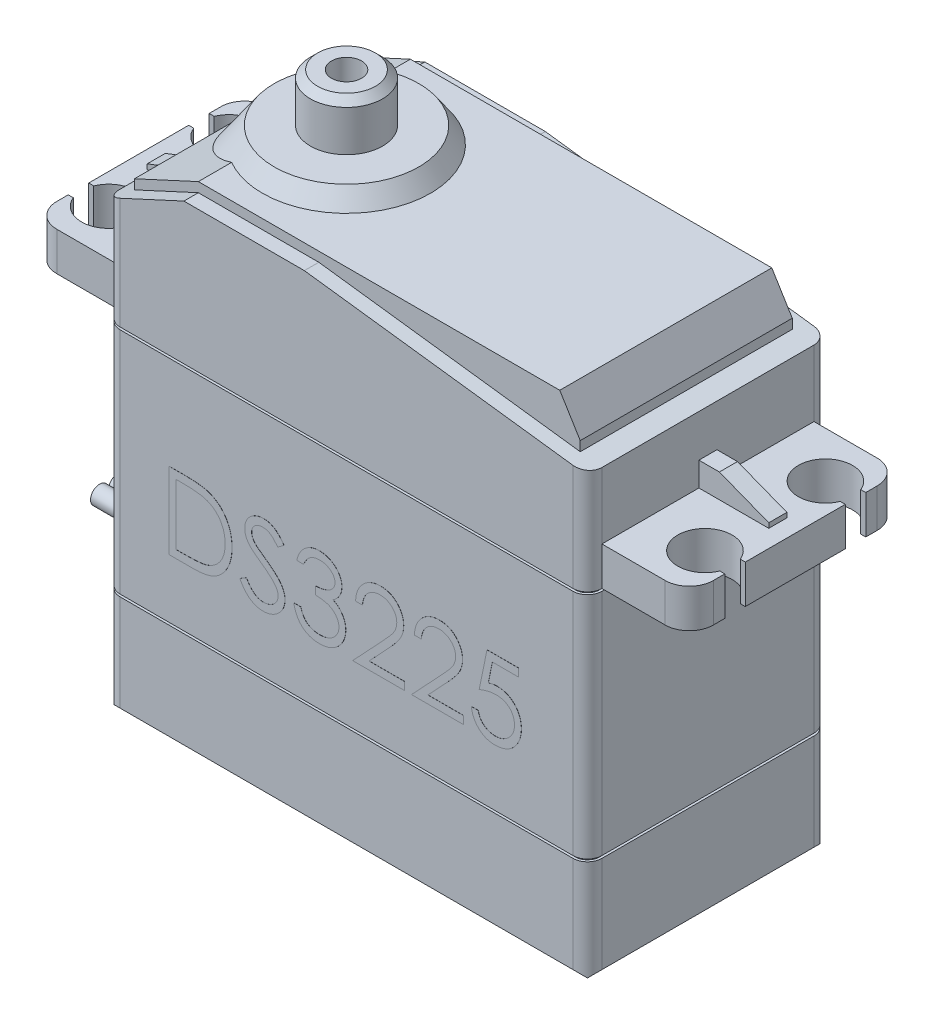
from build123d import *

# Parameters (mm, degrees)
SKETCH1_W              = 40
SKETCH1_H              = 20
BOSS_EXTRUDE1_DEPTH    = 41.5
CHAMFER1_SIZE          = 1.6
FILLET2_R              = 1.2
BOSS_EXTRUDE3_DEPTH    = 3.2
CUT_EXTRUDE1_REACH     = 55.524
BOSS_EXTRUDE4_DEPTH    = 8.8
BOSS_EXTRUDE5_REACH    = 53.797
SKETCH6_R              = 6
BOSS_EXTRUDE5_DRAFT    = 35
SKETCH7_R              = 3
SKETCH7_R_2            = 1.25
BOSS_EXTRUDE6_DEPTH    = 4
CHAMFER2_SIZE          = 0.6
BOSS_EXTRUDE7_DEPTH    = 0.75
CUT_EXTRUDE2_START     = -0.2
CUT_EXTRUDE2_DEPTH     = 0.2
LPATTERN1_COUNT        = 2
LPATTERN1_PITCH        = 19.2
BOSS_EXTRUDE8_DEPTH    = 0.6
SKETCH11_W             = 6.4
SKETCH11_H             = 3.4
BOSS_EXTRUDE9_DEPTH    = 4.2
BOSS_EXTRUDE9_TAPER    = 5
FILLET3_R              = 0.5
SKETCH12_R             = 0.75
BOSS_EXTRUDE11_DEPTH   = 4.2
BOSS_EXTRUDE11_2_DEPTH = 4.2
BOSS_EXTRUDE11_3_DEPTH = 4.2
BOSS_EXTRUDE12_DEPTH   = 0.01


with BuildPart() as part:
    # Sketch1 → Boss-Extrude1 (new body)
    with BuildSketch(Plane(origin=(0, 0, 0), x_dir=(1, 0, 0), z_dir=(0, 1, 0))):
        Rectangle(SKETCH1_W, SKETCH1_H)
    extrude(amount=BOSS_EXTRUDE1_DEPTH)

    # Chamfer1
    chamfer1_edges = [part.edges().sort_by_distance(p)[0] for p in [
        (0, 0, 10),
        (-20, 0, 0),
        (0, 0, -10),
        (20, 0, 0),
    ]]
    chamfer(chamfer1_edges, length=CHAMFER1_SIZE)

    # Fillet2
    fillet2_edges = [part.edges().sort_by_distance(p)[0] for p in [
        (20, 21.55, 10),
        (-20, 21.55, 10),
        (-20, 21.55, -10),
        (20, 21.55, -10),
    ]]
    fillet(fillet2_edges, radius=FILLET2_R)

    # Sketch3 → Boss-Extrude3 (add)
    with BuildSketch(Plane(origin=(0, 29, 0), x_dir=(-1, 0, 0), z_dir=(0, -1, 0))):
        with BuildLine():
            Line((25.25, 8.8), (20, 8.8))
            Line((20, 8.8), (20, 5.85))
            Line((20, 5.85), (22.666733334, 5.85))
            ThreePointArc((22.666733334, 5.85), (24.75, 7.25), (26.833266666, 5.85))
            Line((26.833266666, 5.85), (27.25, 5.85))
            Line((27.25, 5.85), (27.25, 6.8))
            ThreePointArc((27.25, 6.8), (26.664213562, 8.214213562), (25.25, 8.8))
        make_face()
        with BuildLine():
            Line((22.666733334, 4.15), (20, 4.15))
            Line((20, 4.15), (20, -4.15))
            Line((20, -4.15), (22.666733334, -4.15))
            ThreePointArc((22.666733334, -4.15), (24.75, -2.75), (26.833266666, -4.15))
            Line((26.833266666, -4.15), (27.25, -4.15))
            Line((27.25, -4.15), (27.25, 4.15))
            Line((27.25, 4.15), (26.833266666, 4.15))
            ThreePointArc((26.833266666, 4.15), (24.75, 2.75), (22.666733334, 4.15))
        make_face()
        with BuildLine():
            Line((22.666733334, -5.85), (20, -5.85))
            Line((20, -5.85), (20, -8.8))
            Line((20, -8.8), (25.25, -8.8))
            ThreePointArc((25.25, -8.8), (26.664213562, -8.214213562), (27.25, -6.8))
            Line((27.25, -6.8), (27.25, -5.85))
            Line((27.25, -5.85), (26.833266666, -5.85))
            ThreePointArc((26.833266666, -5.85), (24.75, -7.25), (22.666733334, -5.85))
        make_face()
        with BuildLine():
            Line((22.666733334, -4.15), (20, -4.15))
            Line((20, -4.15), (20, -5.85))
            Line((20, -5.85), (22.666733334, -5.85))
            ThreePointArc((22.666733334, -5.85), (22.5, -5), (22.666733334, -4.15))
        make_face()
        with BuildLine():
            Line((22.666733334, 5.85), (20, 5.85))
            Line((20, 5.85), (20, 4.15))
            Line((20, 4.15), (22.666733334, 4.15))
            ThreePointArc((22.666733334, 4.15), (22.5, 5), (22.666733334, 5.85))
        make_face()
        with BuildLine():
            Line((-20, 5.85), (-20, 8.8))
            Line((-20, 8.8), (-25.25, 8.8))
            ThreePointArc((-25.25, 8.8), (-26.664213562, 8.214213562), (-27.25, 6.8))
            Line((-27.25, 6.8), (-27.25, 5.85))
            Line((-27.25, 5.85), (-26.833266666, 5.85))
            ThreePointArc((-26.833266666, 5.85), (-24.75, 7.25), (-22.666733334, 5.85))
            Line((-22.666733334, 5.85), (-20, 5.85))
        make_face()
        with BuildLine():
            Line((-20, 4.15), (-20, 5.85))
            Line((-20, 5.85), (-22.666733334, 5.85))
            ThreePointArc((-22.666733334, 5.85), (-22.542076768, 5.433099297), (-22.5, 5))
            ThreePointArc((-22.5, 5), (-22.542076768, 4.566900703), (-22.666733334, 4.15))
            Line((-22.666733334, 4.15), (-20, 4.15))
        make_face()
        with BuildLine():
            Line((-20, -4.15), (-20, 4.15))
            Line((-20, 4.15), (-22.666733334, 4.15))
            ThreePointArc((-22.666733334, 4.15), (-24.75, 2.75), (-26.833266666, 4.15))
            Line((-26.833266666, 4.15), (-27.25, 4.15))
            Line((-27.25, 4.15), (-27.25, -4.15))
            Line((-27.25, -4.15), (-26.833266666, -4.15))
            ThreePointArc((-26.833266666, -4.15), (-24.75, -2.75), (-22.666733334, -4.15))
            Line((-22.666733334, -4.15), (-20, -4.15))
        make_face()
        with BuildLine():
            Line((-20, -5.85), (-20, -4.15))
            Line((-20, -4.15), (-22.666733334, -4.15))
            ThreePointArc((-22.666733334, -4.15), (-22.542076768, -4.566900703), (-22.5, -5))
            ThreePointArc((-22.5, -5), (-22.542076768, -5.433099297), (-22.666733334, -5.85))
            Line((-22.666733334, -5.85), (-20, -5.85))
        make_face()
        with BuildLine():
            Line((-20, -8.8), (-20, -5.85))
            Line((-20, -5.85), (-22.666733334, -5.85))
            ThreePointArc((-22.666733334, -5.85), (-24.75, -7.25), (-26.833266666, -5.85))
            Line((-26.833266666, -5.85), (-27.25, -5.85))
            Line((-27.25, -5.85), (-27.25, -6.8))
            ThreePointArc((-27.25, -6.8), (-26.664213562, -8.214213562), (-25.25, -8.8))
            Line((-25.25, -8.8), (-20, -8.8))
        make_face()
    extrude(amount=-BOSS_EXTRUDE3_DEPTH)

    # Sketch4 → Cut-Extrude1 (cut, up to next)
    with BuildSketch(Plane.XY.offset(10), mode=Mode.PRIVATE) as cut_extrude1_sk1:
        Polygon((-20, 37.7), (-13.5, 40.7), (-3.5, 40.7), (20, 37.7), (20, 41.5), (-20, 41.5), align=None)
    cut_extrude1_tool1 = extrude(cut_extrude1_sk1.sketch, amount=-CUT_EXTRUDE1_REACH, mode=Mode.PRIVATE) & part.part
    add(cut_extrude1_tool1.solids().sort_by_distance((3.311688, 40.281818, 10))[0], mode=Mode.SUBTRACT)

    # Sketch5 → Boss-Extrude4 (add, symmetric)
    with BuildSketch(Plane.XY):
        Polygon((-13.5, 41.5), (16.5, 41.5), (18.2, 38.729787234), (18.2, 37.929787234), (-3.5, 40.7), (-13.5, 40.7), (-18.8, 38.253846154), (-18.8, 39.053846154), align=None)
    extrude(amount=BOSS_EXTRUDE4_DEPTH, both=True)




with BuildPart() as boss_extrude5_long_prism_1:
    # Sketch6 → Boss-Extrude5 (the long prism of profile 1, to be tilted and cut off)
    with BuildSketch(Plane(origin=(0, 42.9, 0), x_dir=(1, 0, 0), z_dir=(0, 1, 0))):
        with Locations((-10, 0)):
            Circle(SKETCH6_R)
    extrude(amount=-BOSS_EXTRUDE5_REACH)
    boss_extrude5_tool1_sides = [boss_extrude5_long_prism_1.faces().sort_by_distance(p)[0] for p in [
        (-16, 16.0015, 0),
    ]]
    draft(boss_extrude5_tool1_sides, Plane(origin=(0, 42.9, 0), x_dir=(1, 0, 0), z_dir=(0, 1, 0)), BOSS_EXTRUDE5_DRAFT)  # the draft: side faces tilted about the start plane


with BuildPart() as part_1:
    add(part.part)
    boss_extrude5_tool1 = boss_extrude5_long_prism_1.part - part.part
    add(boss_extrude5_tool1.solids().sort_by_distance((-10, 42.9, 0))[0])

    # Sketch7 → Boss-Extrude6 (add)
    with BuildSketch(Plane(origin=(0, 42.9, 0), x_dir=(1, 0, 0), z_dir=(0, 1, 0))):
        with Locations(Location((-10, 0, 0), (0, 0, 270))):
            Circle(SKETCH7_R)
        with Locations(Location((-10, 0, 0), (0, 0, 270))):
            Circle(SKETCH7_R_2, mode=Mode.SUBTRACT)
    extrude(amount=BOSS_EXTRUDE6_DEPTH)

    # Chamfer2
    chamfer2_edges = [part_1.edges().sort_by_distance(p)[0] for p in [
        (-10, 46.9, -3),
    ]]
    chamfer(chamfer2_edges, length=CHAMFER2_SIZE)

    # Sketch8 → Boss-Extrude7 (add, symmetric)
    with BuildSketch(Plane.XY):
        Polygon((-20, 34.2), (-21.7, 34.2), (-25.8, 32.6), (-25.8, 32.2), (-20, 32.2), align=None)
        Polygon((20, 32.2), (20, 34.2), (21.7, 34.2), (25.8, 32.6), (25.8, 32.2), align=None)
    extrude(amount=BOSS_EXTRUDE7_DEPTH, both=True)

    # Sketch9 → Cut-Extrude2 (cut)
    with BuildSketch(Plane(origin=(0, 9.6, 0), x_dir=(-1, 0, 0), z_dir=(0, -1, 0)).offset(CUT_EXTRUDE2_START)):
        with BuildLine():
            Line((20, 8.8), (20, -8.8))
            ThreePointArc((20, -8.8), (19.908655439, -9.259220119), (19.648528137, -9.648528137))
            ThreePointArc((19.648528137, -9.648528137), (19.259220119, -9.908655439), (18.8, -10))
            Line((18.8, -10), (-18.8, -10))
            ThreePointArc((-18.8, -10), (-19.259220119, -9.908655439), (-19.648528137, -9.648528137))
            ThreePointArc((-19.648528137, -9.648528137), (-19.908655439, -9.259220119), (-20, -8.8))
            Line((-20, -8.8), (-20, 8.8))
            ThreePointArc((-20, 8.8), (-19.908655439, 9.259220119), (-19.648528137, 9.648528137))
            ThreePointArc((-19.648528137, 9.648528137), (-19.259220119, 9.908655439), (-18.8, 10))
            Line((-18.8, 10), (18.8, 10))
            ThreePointArc((18.8, 10), (19.259220119, 9.908655439), (19.648528137, 9.648528137))
            ThreePointArc((19.648528137, 9.648528137), (19.908655439, 9.259220119), (20, 8.8))
        make_face()
        with BuildLine():
            Line((-18.8, 9.8), (18.8, 9.8))
            ThreePointArc((18.8, 9.8), (19.182683432, 9.723879533), (19.507106781, 9.507106781))
            ThreePointArc((19.507106781, 9.507106781), (19.723879533, 9.182683432), (19.8, 8.8))
            Line((19.8, 8.8), (19.8, -8.8))
            ThreePointArc((19.8, -8.8), (19.723879533, -9.182683432), (19.507106781, -9.507106781))
            ThreePointArc((19.507106781, -9.507106781), (19.182683432, -9.723879533), (18.8, -9.8))
            Line((18.8, -9.8), (-18.8, -9.8))
            ThreePointArc((-18.8, -9.8), (-19.182683432, -9.723879533), (-19.507106781, -9.507106781))
            ThreePointArc((-19.507106781, -9.507106781), (-19.723879533, -9.182683432), (-19.8, -8.8))
            Line((-19.8, -8.8), (-19.8, 8.8))
            ThreePointArc((-19.8, 8.8), (-19.723879533, 9.182683432), (-19.507106781, 9.507106781))
            ThreePointArc((-19.507106781, 9.507106781), (-19.182683432, 9.723879533), (-18.8, 9.8))
        make_face(mode=Mode.SUBTRACT)
    cut_extrude2 = extrude(amount=CUT_EXTRUDE2_DEPTH, mode=Mode.SUBTRACT)

    # LPattern1: Cut-Extrude2 ×2
    with Locations(*[(0, i * LPATTERN1_PITCH, 0) for i in range(1, LPATTERN1_COUNT)]):
        add(cut_extrude2, mode=Mode.SUBTRACT)

    # Sketch10 → Boss-Extrude8 (add)
    with BuildSketch(Plane.ZY.offset(20)):
        with BuildLine():
            Line((-3, 9.6), (3, 9.6))
            ThreePointArc((3, 9.6), (3.353553391, 9.453553391), (3.5, 9.1))
            Line((3.5, 9.1), (3.5, 6.1))
            ThreePointArc((3.5, 6.1), (3.353553391, 5.746446609), (3, 5.6))
            Line((3, 5.6), (-3, 5.6))
            ThreePointArc((-3, 5.6), (-3.353553391, 5.746446609), (-3.5, 6.1))
            Line((-3.5, 6.1), (-3.5, 9.1))
            ThreePointArc((-3.5, 9.1), (-3.353553391, 9.453553391), (-3, 9.6))
        make_face()
    extrude(amount=BOSS_EXTRUDE8_DEPTH)

    # Sketch11 → Boss-Extrude9 (add)
    with BuildSketch(Plane.ZY.offset(20.6)):
        with Locations((0, 7.6)):
            Rectangle(SKETCH11_W, SKETCH11_H)
    extrude(amount=BOSS_EXTRUDE9_DEPTH, taper=BOSS_EXTRUDE9_TAPER)

    # Fillet3
    fillet3_edges = [part_1.edges().sort_by_distance(p)[0] for p in [
        (-22.7, 6.083726193, 3.016273807),
        (-22.7, 9.116273807, 3.016273807),
        (-22.7, 9.116273807, -3.016273807),
        (-22.7, 6.083726193, -3.016273807),
        (-24.8, 7.6, 2.832547613),
        (-24.8, 8.932547613, 0),
        (-24.8, 7.6, -2.832547613),
        (-24.8, 6.267452387, 0),
    ]]
    fillet(fillet3_edges, radius=FILLET3_R)

    # Sketch13 → Boss-Extrude12 (add)
    # profile 1 of 6: a face of its own
    with BuildSketch(Plane.XY.offset(10)):
        with BuildLine():
            Line((-14.705907337, 14.680709797), (-14.705907337, 21.030709797))
            Line((-14.705907337, 21.030709797), (-13.423695799, 21.030709797))
            add(Edge.make_bspline(
                [(-13.423695799, 21.030709797), (-13.312173491, 21.029906849), (-13.096712974, 21.028355556), (-12.785358963, 21.018519604), (-12.497279851, 21.001119759), (-12.233423092, 20.975775047), (-11.993064322, 20.944654543), (-11.776876561, 20.905646667), (-11.583741959, 20.859585272), (-11.464961688, 20.820314241), (-11.408791952, 20.801743451)],
                knots=[0, 0, 0, 0, 1.314313732, 2.53924729, 3.670748893, 4.714932338, 5.66265055, 6.526160246, 7.303039223, 8, 8, 8, 8], degree=3))
            add(Edge.make_bspline(
                [(-11.408791952, 20.801743451), (-11.335322925, 20.773747742), (-11.190050905, 20.718391174), (-10.983209411, 20.613967599), (-10.788490539, 20.4956524), (-10.60485009, 20.363289621), (-10.436482876, 20.213131446), (-10.276811407, 20.051556447), (-10.132367551, 19.87268903), (-10.000091071, 19.680238695), (-9.880827803, 19.476472543), (-9.777161045, 19.261778846), (-9.691065943, 19.037247911), (-9.619595374, 18.803504143), (-9.56326823, 18.560033571), (-9.524838154, 18.3065527), (-9.499490787, 18.044063314), (-9.496943436, 17.865946787), (-9.495650927, 17.775571576)],
                knots=[0, 0, 0, 0, 0.984719456, 1.947108742, 2.898477687, 3.838006223, 4.779231079, 5.722358779, 6.681677486, 7.655904652, 8.64651281, 9.637519902, 10.640069247, 11.656948941, 12.698408672, 13.768548281, 14.867775369, 16, 16, 16, 16], degree=3))
            add(Edge.make_bspline(
                [(-9.495650927, 17.775571576), (-9.496792054, 17.697083329), (-9.499040763, 17.54241404), (-9.519232522, 17.314465558), (-9.548580988, 17.093279508), (-9.594018318, 16.879909166), (-9.649177164, 16.672485114), (-9.719869267, 16.473218042), (-9.80085081, 16.280279988), (-9.895284161, 16.09627971), (-9.99895496, 15.92195702), (-10.110210123, 15.757627133), (-10.228930984, 15.605634945), (-10.356249633, 15.465520178), (-10.490520775, 15.337494057), (-10.632623489, 15.220487115), (-10.782924453, 15.116788794), (-10.940750478, 15.022324183), (-11.110705741, 14.939918681), (-11.296009384, 14.870195663), (-11.497451664, 14.812416804), (-11.714538129, 14.764209607), (-11.947643867, 14.725969358), (-12.19699742, 14.700340046), (-12.462215674, 14.683008297), (-12.644332341, 14.68149084), (-12.738068795, 14.680709797)],
                knots=[0, 0, 0, 0, 1.105936401, 2.179363191, 3.223086493, 4.248585256, 5.251745608, 6.245858792, 7.225916811, 8.198733463, 9.158002045, 10.082870192, 10.993790845, 11.873723703, 12.748670949, 13.606408763, 14.465103618, 15.319838547, 16.196477973, 17.123216899, 18.106603292, 19.147568657, 20.255746949, 21.433717677, 22.679120308, 24, 24, 24, 24], degree=3))
            Line((-12.738068795, 14.680709797), (-14.705907337, 14.680709797))
        make_face()
        with BuildLine():
            Line((-14.136035542, 15.331991848), (-13.40715934, 15.331991848))
            add(Edge.make_bspline(
                [(-13.40715934, 15.331991848), (-13.302423582, 15.332441966), (-13.100978362, 15.333307707), (-12.811313138, 15.34090449), (-12.546646233, 15.35331772), (-12.306940066, 15.370689646), (-12.092329979, 15.393674134), (-11.902367462, 15.419300743), (-11.737675207, 15.451227547), (-11.638017515, 15.480167145), (-11.591965029, 15.493540326)],
                knots=[0, 0, 0, 0, 1.375205317, 2.645023457, 3.804390687, 4.853969522, 5.800190428, 6.637939096, 7.370582563, 8, 8, 8, 8], degree=3))
            add(Edge.make_bspline(
                [(-11.591965029, 15.493540326), (-11.534001573, 15.513953867), (-11.419459115, 15.554293373), (-11.25457486, 15.627876558), (-11.100801437, 15.715038599), (-10.955458963, 15.811925582), (-10.820609174, 15.921954757), (-10.694653991, 16.042733551), (-10.577847009, 16.174876643), (-10.47139505, 16.318220022), (-10.376129984, 16.471871508), (-10.293632182, 16.634320535), (-10.221330118, 16.803787176), (-10.164581814, 16.982873793), (-10.12010354, 17.16997937), (-10.088599035, 17.365117071), (-10.068978035, 17.568250454), (-10.066689408, 17.706412165), (-10.065522722, 17.776843611)],
                knots=[0, 0, 0, 0, 0.998632004, 1.973411704, 2.929992603, 3.868527914, 4.809262121, 5.754881198, 6.702106254, 7.672490631, 8.653608572, 9.636854334, 10.631411391, 11.644891563, 12.686317036, 13.754757253, 14.855430412, 16, 16, 16, 16], degree=3))
            add(Edge.make_bspline(
                [(-10.065522722, 17.776843611), (-10.066453972, 17.85110864), (-10.06828342, 17.997002946), (-10.091278241, 18.211071778), (-10.124881634, 18.416958102), (-10.173474893, 18.614675685), (-10.235398059, 18.804610266), (-10.312676909, 18.985711378), (-10.400972061, 19.15989164), (-10.506025258, 19.323130846), (-10.621079263, 19.477514059), (-10.748764844, 19.618946548), (-10.8870534, 19.747750493), (-11.034436627, 19.865931817), (-11.195068221, 19.968735915), (-11.365164203, 20.060696037), (-11.547219921, 20.138739154), (-11.673880097, 20.180247948), (-11.738249084, 20.20134281)],
                knots=[0, 0, 0, 0, 1.122418816, 2.205001699, 3.251619955, 4.274784885, 5.280384055, 6.268708349, 7.249350384, 8.229342522, 9.199999885, 10.157847722, 11.105861043, 12.055065948, 13.010012805, 13.98527497, 14.976112212, 16, 16, 16, 16], degree=3))
            add(Edge.make_bspline(
                [(-11.738249084, 20.20134281), (-11.791500449, 20.216068329), (-11.904727463, 20.247378823), (-12.089493348, 20.281533427), (-12.297437976, 20.311658733), (-12.529484577, 20.337164033), (-12.785368638, 20.355465316), (-13.065286958, 20.369201844), (-13.369360526, 20.378466734), (-13.580148838, 20.379099388), (-13.689551167, 20.379427746)],
                knots=[0, 0, 0, 0, 0.674548936, 1.434276114, 2.292660221, 3.240891867, 4.284742987, 5.42552168, 6.663806718, 8, 8, 8, 8], degree=3))
            Line((-13.689551167, 20.379427746), (-14.136035542, 20.379427746))
            Line((-14.136035542, 20.379427746), (-14.136035542, 15.331991848))
        make_face(mode=Mode.SUBTRACT)
    # profile 2 of 6: a face of its own
    with BuildSketch(Plane.XY.offset(10)):
        with BuildLine():
            Line((-8.844368876, 15.905679749), (-8.307569997, 16.227504669))
            add(Edge.make_bspline(
                [(-8.307569997, 16.227504669), (-8.257644053, 16.143930713), (-8.161987869, 15.98380624), (-8.002418975, 15.767438081), (-7.837077836, 15.583538168), (-7.664740045, 15.433176322), (-7.486457539, 15.314796199), (-7.30106647, 15.23097215), (-7.109191585, 15.178691738), (-6.978610509, 15.172341581), (-6.913419356, 15.169171336)],
                knots=[0, 0, 0, 0, 1.272034388, 2.437168799, 3.508375237, 4.49857839, 5.41946034, 6.295179144, 7.148887113, 8, 8, 8, 8], degree=3))
            add(Edge.make_bspline(
                [(-6.913419356, 15.169171336), (-6.857744624, 15.170721956), (-6.747369335, 15.173796064), (-6.584877838, 15.20333409), (-6.427067996, 15.248713238), (-6.277192325, 15.313702643), (-6.137318853, 15.392331038), (-6.014660991, 15.48730196), (-5.908623043, 15.593630362), (-5.82188365, 15.712253178), (-5.755335586, 15.839828577), (-5.704187119, 15.970776374), (-5.675802485, 16.107153634), (-5.671526661, 16.198975473), (-5.669368876, 16.245313162)],
                knots=[0, 0, 0, 0, 1.095163259, 2.171163733, 3.241058638, 4.321873601, 5.38011039, 6.391990106, 7.366004449, 8.327778327, 9.272591725, 10.192022065, 11.087607919, 12, 12, 12, 12], degree=3))
            add(Edge.make_bspline(
                [(-5.669368876, 16.245313162), (-5.672043696, 16.29818299), (-5.677481216, 16.405659623), (-5.723439759, 16.564227565), (-5.795737678, 16.721149799), (-5.862435617, 16.818216381), (-5.897063186, 16.868610438)],
                knots=[0, 0, 0, 0, 0.938893495, 1.908633276, 2.914225137, 4, 4, 4, 4], degree=3))
            add(Edge.make_bspline(
                [(-5.897063186, 16.868610438), (-5.925494158, 16.904981104), (-5.985181426, 16.981336767), (-6.087792913, 17.094993123), (-6.208200006, 17.212229397), (-6.34228217, 17.337522258), (-6.494923631, 17.465044403), (-6.66134355, 17.60087685), (-6.845790837, 17.739853997), (-6.975148496, 17.833058509), (-7.041894917, 17.881150502)],
                knots=[0, 0, 0, 0, 0.722233717, 1.516239348, 2.393582979, 3.351407094, 4.387010283, 5.505090956, 6.712668013, 8, 8, 8, 8], degree=3))
            add(Edge.make_bspline(
                [(-7.041894917, 17.881150502), (-7.108704167, 17.928736654), (-7.236438366, 18.019717753), (-7.415070366, 18.154744668), (-7.574808177, 18.278195688), (-7.714941822, 18.391232967), (-7.835409662, 18.493871836), (-7.937160993, 18.585126669), (-8.017603804, 18.667465415), (-8.062336071, 18.72088042), (-8.082419757, 18.744862441)],
                knots=[0, 0, 0, 0, 1.452282411, 2.77665338, 3.964542531, 5.026858415, 5.96415736, 6.766646006, 7.446254459, 8, 8, 8, 8], degree=3))
            add(Edge.make_bspline(
                [(-8.082419757, 18.744862441), (-8.110491375, 18.782238608), (-8.165697979, 18.855743856), (-8.238570588, 18.970633241), (-8.300508784, 19.088241166), (-8.349063301, 19.208883663), (-8.389950441, 19.330867034), (-8.417451258, 19.455782865), (-8.434671364, 19.583070644), (-8.436434825, 19.668729424), (-8.437317594, 19.711609236)],
                knots=[0, 0, 0, 0, 1.068054152, 2.10047183, 3.106115577, 4.101338837, 5.06977816, 6.043150881, 7.020423561, 8, 8, 8, 8], degree=3))
            add(Edge.make_bspline(
                [(-8.437317594, 19.711609236), (-8.434949571, 19.778791827), (-8.430264142, 19.911721029), (-8.390639204, 20.105905535), (-8.328095525, 20.291300892), (-8.2404748, 20.46607164), (-8.127522174, 20.625667063), (-7.996810192, 20.771922961), (-7.841123638, 20.894874531), (-7.670303879, 21.002302123), (-7.483330175, 21.086386873), (-7.287403822, 21.14981608), (-7.08221342, 21.185755733), (-6.943233447, 21.190913321), (-6.872714228, 21.19353031)],
                knots=[0, 0, 0, 0, 1.005424448, 1.989358655, 2.955360095, 3.929531133, 4.905563448, 5.876582895, 6.856512386, 7.866279853, 8.892233794, 9.918561126, 10.94386622, 12, 12, 12, 12], degree=3))
            add(Edge.make_bspline(
                [(-6.872714228, 21.19353031), (-6.797885646, 21.190949395), (-6.649075479, 21.185816779), (-6.430183331, 21.141189829), (-6.219434603, 21.067347181), (-6.049901822, 20.983547759), (-5.917218098, 20.899852191), (-5.816030426, 20.823616224), (-5.713491622, 20.735849955), (-5.60877458, 20.636319609), (-5.503653669, 20.524111932), (-5.396568263, 20.399995396), (-5.287267947, 20.264728502), (-5.216953743, 20.168164051), (-5.180907337, 20.118660518)],
                knots=[0, 0, 0, 0, 1.286793592, 2.559021753, 3.825965368, 5.121522368, 5.803751409, 6.523245864, 7.299691795, 8.125521123, 9.008227632, 9.944561021, 10.946284179, 12, 12, 12, 12], degree=3))
            Line((-5.180907337, 20.118660518), (-5.696081616, 19.728145694))
            add(Edge.make_bspline(
                [(-5.696081616, 19.728145694), (-5.727189236, 19.76822089), (-5.78709524, 19.845396347), (-5.878044452, 19.953475733), (-5.963766999, 20.052202775), (-6.048222724, 20.137955221), (-6.12695117, 20.215429092), (-6.203363518, 20.281758936), (-6.276360126, 20.33759466), (-6.368375093, 20.397182261), (-6.483977239, 20.456249061), (-6.62909204, 20.506230959), (-6.780741425, 20.536266572), (-6.884028042, 20.540237839), (-6.936315991, 20.542248259)],
                knots=[0, 0, 0, 0, 1.181633172, 2.275549214, 3.290209073, 4.226197932, 5.078386478, 5.862611352, 6.581680152, 7.217281963, 8.414376989, 9.595101626, 10.782541182, 12, 12, 12, 12], degree=3))
            add(Edge.make_bspline(
                [(-6.936315991, 20.542248259), (-7.001914253, 20.540049889), (-7.128414322, 20.535810539), (-7.308010893, 20.489509995), (-7.469652729, 20.41660862), (-7.608540954, 20.314437159), (-7.724178041, 20.193386215), (-7.807826516, 20.054087435), (-7.858173243, 19.900267934), (-7.864316922, 19.792968071), (-7.867445799, 19.738321977)],
                knots=[0, 0, 0, 0, 1.14458467, 2.207223713, 3.21896685, 4.227309161, 5.202851033, 6.127160689, 7.046193047, 8, 8, 8, 8], degree=3))
            add(Edge.make_bspline(
                [(-7.867445799, 19.738321977), (-7.866732555, 19.704301437), (-7.8653049, 19.636204727), (-7.845393482, 19.535600005), (-7.81981327, 19.435249432), (-7.779277353, 19.335604174), (-7.723315159, 19.234921551), (-7.649827197, 19.131467828), (-7.557274474, 19.024331156), (-7.486377609, 18.954649207), (-7.448946199, 18.917859236)],
                knots=[0, 0, 0, 0, 0.858281714, 1.717966888, 2.583508476, 3.4729293, 4.427298488, 5.488583878, 6.674047936, 8, 8, 8, 8], degree=3))
            add(Edge.make_bspline(
                [(-7.448946199, 18.917859236), (-7.435046281, 18.905454918), (-7.402023256, 18.875985097), (-7.341651219, 18.827739102), (-7.261926428, 18.768225501), (-7.16493072, 18.694588513), (-7.04887565, 18.609169288), (-6.913748455, 18.513060021), (-6.761055389, 18.403140688), (-6.65270277, 18.326292007), (-6.595410542, 18.285657714)],
                knots=[0, 0, 0, 0, 0.420754252, 0.999615792, 1.744751191, 2.668019286, 3.750313428, 4.999500688, 6.413464383, 8, 8, 8, 8], degree=3))
            add(Edge.make_bspline(
                [(-6.595410542, 18.285657714), (-6.526493242, 18.23550839), (-6.393044443, 18.138401175), (-6.203165691, 17.992504156), (-6.03100121, 17.849814633), (-5.875946541, 17.711243831), (-5.736469864, 17.577842862), (-5.614118571, 17.448006807), (-5.50764598, 17.322665839), (-5.393020826, 17.16196988), (-5.275894496, 16.964609913), (-5.175307762, 16.722805109), (-5.111883331, 16.480060356), (-5.103589296, 16.316907381), (-5.099497081, 16.236408916)],
                knots=[0, 0, 0, 0, 1.163667725, 2.253281268, 3.268753668, 4.215851969, 5.092017293, 5.902905408, 6.650798638, 7.335211899, 8.59617414, 9.77448103, 10.901945474, 12, 12, 12, 12], degree=3))
            add(Edge.make_bspline(
                [(-5.099497081, 16.236408916), (-5.100689317, 16.179479596), (-5.103050637, 16.066726486), (-5.130194009, 15.901163704), (-5.169962545, 15.740361983), (-5.229901526, 15.586308965), (-5.303059256, 15.436186324), (-5.395889449, 15.29393199), (-5.503490534, 15.156397524), (-5.626923222, 15.027250333), (-5.761989359, 14.908693663), (-5.904744062, 14.803230937), (-6.055420986, 14.71529555), (-6.213202732, 14.643539023), (-6.378125543, 14.587416784), (-6.55013395, 14.546753435), (-6.729511492, 14.521796646), (-6.851432366, 14.519206278), (-6.913419356, 14.517889284)],
                knots=[0, 0, 0, 0, 0.983748083, 1.948392443, 2.894712957, 3.844097841, 4.80183111, 5.778335162, 6.776009319, 7.81870978, 8.863265674, 9.881300176, 10.883814829, 11.87499822, 12.874611388, 13.892143829, 14.928324115, 16, 16, 16, 16], degree=3))
            add(Edge.make_bspline(
                [(-6.913419356, 14.517889284), (-6.961380621, 14.518816714), (-7.056699129, 14.520659893), (-7.197686332, 14.536954501), (-7.335825301, 14.560008818), (-7.469382641, 14.596610345), (-7.600079088, 14.641018575), (-7.727346213, 14.695698121), (-7.851245697, 14.761225044), (-7.972471883, 14.836146017), (-8.090716457, 14.923336496), (-8.204870349, 15.024888411), (-8.318679014, 15.13800097), (-8.42878329, 15.265745849), (-8.53741028, 15.406059228), (-8.642418252, 15.56025389), (-8.745980797, 15.727489946), (-8.810960288, 15.845173744), (-8.844368876, 15.905679749)],
                knots=[0, 0, 0, 0, 0.915332311, 1.819136955, 2.706846663, 3.586547465, 4.459518054, 5.340707479, 6.227863349, 7.133153174, 8.059268498, 9.028702269, 10.047606654, 11.120612155, 12.245963614, 13.433783089, 14.680604001, 16, 16, 16, 16], degree=3))
        make_face()
    # profile 3 of 6: a face of its own
    with BuildSketch(Plane.XY.offset(10)):
        with BuildLine():
            Line((-3.552702209, 19.565325182), (-4.122574004, 19.565325182))
            add(Edge.make_bspline(
                [(-4.122574004, 19.565325182), (-4.107135248, 19.629246974), (-4.076953742, 19.75420885), (-4.01400243, 19.932747737), (-3.945423781, 20.101700412), (-3.863074977, 20.257903288), (-3.773251952, 20.404495583), (-3.670340728, 20.538152423), (-3.559089232, 20.662273089), (-3.436035395, 20.772424249), (-3.306987681, 20.872169558), (-3.170127728, 20.957214304), (-3.028209049, 21.030373839), (-2.880248365, 21.090644831), (-2.725805168, 21.136048281), (-2.566275708, 21.168989914), (-2.401241929, 21.190382364), (-2.289214158, 21.192470177), (-2.232329613, 21.19353031)],
                knots=[0, 0, 0, 0, 1.162005537, 2.271625781, 3.343758855, 4.383309926, 5.390229558, 6.379919256, 7.361854164, 8.333198761, 9.295911338, 10.242430842, 11.177959212, 12.116337295, 13.062827104, 14.020064771, 14.994644689, 16, 16, 16, 16], degree=3))
            add(Edge.make_bspline(
                [(-2.232329613, 21.19353031), (-2.149448066, 21.191027992), (-1.985492861, 21.186077939), (-1.744622761, 21.140876033), (-1.512345532, 21.069347579), (-1.291203611, 20.970516674), (-1.085793027, 20.848619691), (-0.903028802, 20.703540812), (-0.745388218, 20.538079222), (-0.61313699, 20.355321569), (-0.509586635, 20.160003717), (-0.433229928, 19.958980574), (-0.386744879, 19.752728998), (-0.38072044, 19.613469363), (-0.377702209, 19.543700582)],
                knots=[0, 0, 0, 0, 1.083050992, 2.142477498, 3.193116406, 4.255571735, 5.30263384, 6.308962982, 7.297363603, 8.282367274, 9.249857812, 10.179914175, 11.08814088, 12, 12, 12, 12], degree=3))
            add(Edge.make_bspline(
                [(-0.377702209, 19.543700582), (-0.379813296, 19.476559683), (-0.383944364, 19.345175363), (-0.41902123, 19.153366361), (-0.478051307, 18.972588029), (-0.559820734, 18.802079349), (-0.665668975, 18.642921426), (-0.793889439, 18.494756167), (-0.945387125, 18.356926408), (-1.060193199, 18.27796965), (-1.119298763, 18.237320374)],
                knots=[0, 0, 0, 0, 1.024540389, 2.004866551, 2.965041327, 3.920577974, 4.882998113, 5.874504559, 6.905732034, 8, 8, 8, 8], degree=3))
            add(Edge.make_bspline(
                [(-1.119298763, 18.237320374), (-1.051749723, 18.204702834), (-0.917915537, 18.140078054), (-0.735488147, 18.013339751), (-0.569884002, 17.867006092), (-0.477530112, 17.752810136), (-0.43112769, 17.695433355)],
                knots=[0, 0, 0, 0, 1.015518401, 2.012035669, 3.001164323, 4, 4, 4, 4], degree=3))
            add(Edge.make_bspline(
                [(-0.43112769, 17.695433355), (-0.400572683, 17.653600005), (-0.339963029, 17.570618357), (-0.265149989, 17.43720227), (-0.197279167, 17.302307425), (-0.144392341, 17.162318217), (-0.103436896, 17.018857178), (-0.074161524, 16.871677973), (-0.055974868, 16.720660419), (-0.053370367, 16.61849349), (-0.052061183, 16.567138082)],
                knots=[0, 0, 0, 0, 1.025084078, 2.033381695, 3.024893161, 4.013698104, 4.991890475, 5.976764909, 6.982997093, 8, 8, 8, 8], degree=3))
            add(Edge.make_bspline(
                [(-0.052061183, 16.567138082), (-0.055316944, 16.478220445), (-0.061813142, 16.300803619), (-0.119877677, 16.038685196), (-0.209890271, 15.782461784), (-0.337719283, 15.537397433), (-0.493507478, 15.308107313), (-0.678850052, 15.102954581), (-0.891641107, 14.926608542), (-1.128959927, 14.779269985), (-1.386075289, 14.661490326), (-1.66107672, 14.579743252), (-1.950001818, 14.526501224), (-2.148135058, 14.520791904), (-2.248866071, 14.517889284)],
                knots=[0, 0, 0, 0, 0.955779014, 1.907060117, 2.875433937, 3.871313158, 4.872415639, 5.851225146, 6.836215519, 7.83643374, 8.849228613, 9.86973379, 10.916971861, 12, 12, 12, 12], degree=3))
            add(Edge.make_bspline(
                [(-2.248866071, 14.517889284), (-2.316755373, 14.519464471), (-2.450338881, 14.522563914), (-2.646723514, 14.543752233), (-2.834178597, 14.582450957), (-3.012957581, 14.634526954), (-3.18321929, 14.700551971), (-3.344444167, 14.782773038), (-3.497624116, 14.879495334), (-3.641313642, 14.991860558), (-3.775495615, 15.117556703), (-3.896604129, 15.258815193), (-4.006658325, 15.413024768), (-4.102711398, 15.581976599), (-4.18913844, 15.76348728), (-4.26022389, 15.959880984), (-4.322790565, 16.169401995), (-4.35187985, 16.31541161), (-4.366804773, 16.390325182)],
                knots=[0, 0, 0, 0, 1.048658725, 2.063410685, 3.046034179, 4.001477787, 4.936774919, 5.862367409, 6.792675028, 7.730719943, 8.675894397, 9.627829632, 10.600096036, 11.597688215, 12.626045268, 13.701542398, 14.82072376, 16, 16, 16, 16], degree=3))
            Line((-4.366804773, 16.390325182), (-3.796932978, 16.390325182))
            add(Edge.make_bspline(
                [(-3.796932978, 16.390325182), (-3.782086149, 16.341431972), (-3.753207778, 16.246330432), (-3.70405098, 16.109460163), (-3.648047115, 15.983987695), (-3.587967844, 15.868992602), (-3.524869806, 15.763342386), (-3.454267014, 15.66983071), (-3.381388708, 15.584350271), (-3.326453309, 15.536190761), (-3.299567193, 15.512620855)],
                knots=[0, 0, 0, 0, 1.198163088, 2.33053128, 3.407730985, 4.417276592, 5.372219308, 6.28897303, 7.162600585, 8, 8, 8, 8], degree=3))
            add(Edge.make_bspline(
                [(-3.299567193, 15.512620855), (-3.264013404, 15.48521002), (-3.193015573, 15.430472963), (-3.077321782, 15.360620008), (-2.955646917, 15.300093576), (-2.82535458, 15.253858871), (-2.689256353, 15.21471083), (-2.545152419, 15.189092173), (-2.394314125, 15.171515063), (-2.291321183, 15.169963973), (-2.238689789, 15.169171336)],
                knots=[0, 0, 0, 0, 0.946170439, 1.889420265, 2.845303464, 3.807233317, 4.801018734, 5.828864929, 6.890507805, 8, 8, 8, 8], degree=3))
            add(Edge.make_bspline(
                [(-2.238689789, 15.169171336), (-2.179265577, 15.170288764), (-2.063066661, 15.172473798), (-1.893512844, 15.192568294), (-1.732209332, 15.221833473), (-1.580947024, 15.267032742), (-1.437744532, 15.322878001), (-1.304609254, 15.392997251), (-1.179793461, 15.475265532), (-1.064895825, 15.568772291), (-0.961580405, 15.671137003), (-0.870613002, 15.778203575), (-0.793279688, 15.88952058), (-0.730898053, 16.005704028), (-0.681639197, 16.126272801), (-0.648105391, 16.251565248), (-0.62478907, 16.380556002), (-0.622890217, 16.46823856), (-0.621932978, 16.512440566)],
                knots=[0, 0, 0, 0, 1.217147791, 2.380027433, 3.494444702, 4.572153297, 5.609568379, 6.639424714, 7.649109417, 8.668170816, 9.669597737, 10.625200337, 11.543417969, 12.441394052, 13.322311151, 14.205496177, 15.095365482, 16, 16, 16, 16], degree=3))
            add(Edge.make_bspline(
                [(-0.621932978, 16.512440566), (-0.624709382, 16.571606853), (-0.630248376, 16.689645022), (-0.672536798, 16.863304049), (-0.742094452, 17.030623669), (-0.839471723, 17.188749174), (-0.958009402, 17.335299738), (-1.096557161, 17.466057999), (-1.256265518, 17.573953736), (-1.403258709, 17.648500298), (-1.533461208, 17.699367563), (-1.644886262, 17.733249284), (-1.769630386, 17.761939774), (-1.906185047, 17.788632038), (-2.055579168, 17.811349341), (-2.217650106, 17.830293778), (-2.392430702, 17.84545221), (-2.513427531, 17.852221483), (-2.575779132, 17.855709797)],
                knots=[0, 0, 0, 0, 1.07054697, 2.135767047, 3.216561865, 4.33974944, 5.486079747, 6.621378074, 7.775625952, 8.963672916, 9.598146892, 10.304877434, 11.070270905, 11.915000392, 12.823868403, 13.805723172, 14.86925407, 16, 16, 16, 16], degree=3))
            Line((-2.575779132, 17.855709797), (-2.575779132, 18.506991848))
            add(Edge.make_bspline(
                [(-2.575779132, 18.506991848), (-2.497218446, 18.508324992), (-2.34333736, 18.510936294), (-2.118557693, 18.542519398), (-1.903613255, 18.586208538), (-1.703267594, 18.653128815), (-1.520662071, 18.730853354), (-1.362239365, 18.821299505), (-1.230218969, 18.921837693), (-1.125242454, 19.034019713), (-1.046267996, 19.154334156), (-0.988525092, 19.279731521), (-0.954415929, 19.411310889), (-0.949862676, 19.501108358), (-0.947574004, 19.546244653)],
                knots=[0, 0, 0, 0, 1.321986639, 2.589447074, 3.816329219, 5.01088745, 6.139805852, 7.153945165, 8.075214402, 8.924034688, 9.728124013, 10.488707548, 11.240355623, 12, 12, 12, 12], degree=3))
            add(Edge.make_bspline(
                [(-0.947574004, 19.546244653), (-0.948325864, 19.579405705), (-0.949821653, 19.645378045), (-0.968685286, 19.741762098), (-0.99703176, 19.835199528), (-1.036002126, 19.925292984), (-1.088163201, 20.011417624), (-1.150585491, 20.09430771), (-1.22491333, 20.173489995), (-1.310085784, 20.247295717), (-1.401547201, 20.31763419), (-1.501786079, 20.377348932), (-1.607780052, 20.428412116), (-1.719646468, 20.470520784), (-1.837748359, 20.502196921), (-1.961530828, 20.524940519), (-2.091229911, 20.539160264), (-2.179715767, 20.541207533), (-2.224697401, 20.542248259)],
                knots=[0, 0, 0, 0, 0.884392785, 1.759457502, 2.611959086, 3.489218968, 4.37281399, 5.2945488, 6.255912374, 7.266815255, 8.301784654, 9.332968512, 10.37626691, 11.440494194, 12.520033166, 13.637162961, 14.798855837, 16, 16, 16, 16], degree=3))
            add(Edge.make_bspline(
                [(-2.224697401, 20.542248259), (-2.296999713, 20.53972393), (-2.438222945, 20.53479333), (-2.641812865, 20.491607863), (-2.831077943, 20.422704769), (-2.975746666, 20.340457719), (-3.082576479, 20.259267646), (-3.158916067, 20.188361031), (-3.233883279, 20.10956148), (-3.30254615, 20.01801557), (-3.371986079, 19.919922965), (-3.435204069, 19.810297143), (-3.496635225, 19.691997742), (-3.53365128, 19.60836709), (-3.552702209, 19.565325182)],
                knots=[0, 0, 0, 0, 1.472543308, 2.876219568, 4.221790263, 5.565193594, 6.249813518, 6.953379497, 7.687249741, 8.463570142, 9.283606569, 10.136032583, 11.040678096, 12, 12, 12, 12], degree=3))
        make_face()
    # profile 4 of 6: a face of its own
    with BuildSketch(Plane.XY.offset(10)):
        with BuildLine():
            Line((1.331913176, 19.076863643), (0.762041381, 19.076863643))
            add(Edge.make_bspline(
                [(0.762041381, 19.076863643), (0.765755501, 19.15246654), (0.773049935, 19.300948616), (0.807209831, 19.517436275), (0.85608828, 19.724364267), (0.925197061, 19.920071111), (1.011024165, 20.106287232), (1.113948643, 20.282272975), (1.235857486, 20.447356989), (1.374118275, 20.60000889), (1.524284234, 20.740049197), (1.686310725, 20.860980852), (1.856572417, 20.963157199), (2.034552755, 21.048576023), (2.222259777, 21.112692601), (2.417990105, 21.160266147), (2.622603681, 21.188888946), (2.762013436, 21.191965585), (2.832914778, 21.19353031)],
                knots=[0, 0, 0, 0, 1.10065271, 2.161652631, 3.183658789, 4.190468796, 5.17591951, 6.163126047, 7.15150782, 8.156236427, 9.156009102, 10.134482811, 11.092018607, 12.041330605, 13.001268258, 13.972401359, 14.968799086, 16, 16, 16, 16], degree=3))
            add(Edge.make_bspline(
                [(2.832914778, 21.19353031), (2.90254357, 21.191900253), (3.039361658, 21.18869725), (3.239045598, 21.161190811), (3.429141547, 21.118109524), (3.609277923, 21.05766584), (3.778017498, 20.976414093), (3.936627879, 20.878809987), (4.08699735, 20.765925436), (4.222355371, 20.633022088), (4.346648601, 20.49114062), (4.453876978, 20.339669709), (4.545703717, 20.183225147), (4.622244222, 20.020613982), (4.678588932, 19.850305116), (4.721366538, 19.674778048), (4.745546274, 19.492215891), (4.749257256, 19.36865114), (4.751143945, 19.305829989)],
                knots=[0, 0, 0, 0, 1.111607364, 2.184268762, 3.212621178, 4.221274766, 5.211760367, 6.196651075, 7.1921475, 8.207485113, 9.220403448, 10.201281604, 11.166441695, 12.114753415, 13.065576456, 14.026450734, 14.996634279, 16, 16, 16, 16], degree=3))
            add(Edge.make_bspline(
                [(4.751143945, 19.305829989), (4.748071882, 19.217387489), (4.741981667, 19.04205453), (4.689885584, 18.784398994), (4.6085212, 18.534765219), (4.510554567, 18.333856114), (4.41172599, 18.171961061), (4.322667226, 18.038667839), (4.21840964, 17.895147918), (4.097435794, 17.741881892), (3.962248154, 17.577669249), (3.811622229, 17.402609192), (3.644483912, 17.21851041), (3.527174918, 17.092770247), (3.466388336, 17.027614845)],
                knots=[0, 0, 0, 0, 1.184426356, 2.348067706, 3.509069118, 4.696110526, 5.333549288, 6.050745305, 6.844228056, 7.710549037, 8.667450064, 9.695053472, 10.805634456, 12, 12, 12, 12], degree=3))
            Line((3.466388336, 17.027614845), (1.877616301, 15.331991848))
            Line((1.877616301, 15.331991848), (4.832554201, 15.331991848))
            Line((4.832554201, 15.331991848), (4.832554201, 14.680709797))
            Line((4.832554201, 14.680709797), (0.517810612, 14.680709797))
            Line((0.517810612, 14.680709797), (2.980470868, 17.308734637))
            add(Edge.make_bspline(
                [(2.980470868, 17.308734637), (3.040429177, 17.371324422), (3.155596818, 17.491546589), (3.318488064, 17.667065959), (3.464790229, 17.829897269), (3.595450355, 17.979732864), (3.707634001, 18.118764423), (3.807187907, 18.242489099), (3.886954051, 18.356343602), (3.973523412, 18.488315858), (4.057368778, 18.649446777), (4.129418338, 18.846357899), (4.173350992, 19.049063057), (4.178621193, 19.186045324), (4.18127215, 19.254948579)],
                knots=[0, 0, 0, 0, 1.329631726, 2.553950428, 3.673215718, 4.687767853, 5.603093632, 6.413772471, 7.123043292, 7.734684054, 8.834405432, 9.900288307, 10.943827018, 12, 12, 12, 12], degree=3))
            add(Edge.make_bspline(
                [(4.18127215, 19.254948579), (4.180118732, 19.298276259), (4.177845566, 19.383666796), (4.157783744, 19.508862959), (4.127466111, 19.62963055), (4.084022571, 19.746341044), (4.026678914, 19.857821013), (3.956877211, 19.964206156), (3.876340953, 20.067056136), (3.783175079, 20.163491405), (3.680828464, 20.251813021), (3.572707468, 20.330052433), (3.458316565, 20.395437677), (3.338138058, 20.449038021), (3.212506992, 20.491084784), (3.081180383, 20.520219636), (2.944521096, 20.538512142), (2.85120604, 20.54098714), (2.803657967, 20.542248259)],
                knots=[0, 0, 0, 0, 0.991446411, 1.95395049, 2.89581595, 3.838931463, 4.798493298, 5.75982156, 6.748411868, 7.785213223, 8.824556874, 9.840280684, 10.836137867, 11.835679398, 12.848801643, 13.863922112, 14.911575587, 16, 16, 16, 16], degree=3))
            add(Edge.make_bspline(
                [(2.803657967, 20.542248259), (2.753999457, 20.540950986), (2.656478341, 20.538403356), (2.513296666, 20.520582237), (2.376706756, 20.489837641), (2.246365018, 20.447788532), (2.122050912, 20.394342308), (2.004369003, 20.327772999), (1.893583476, 20.248337233), (1.789486069, 20.158275081), (1.693575707, 20.058003862), (1.609307804, 19.946225786), (1.535676807, 19.824981761), (1.47143434, 19.694598933), (1.419263303, 19.553894218), (1.37939773, 19.403367097), (1.347853022, 19.243671162), (1.337314706, 19.133389651), (1.331913176, 19.076863643)],
                knots=[0, 0, 0, 0, 1.031018746, 2.02475058, 2.990194455, 3.934040569, 4.864654155, 5.795059489, 6.735614925, 7.690564532, 8.649604399, 9.611025574, 10.590972636, 11.591080095, 12.624614302, 13.701020113, 14.821632451, 16, 16, 16, 16], degree=3))
        make_face()
    # profile 5 of 6: a face of its own
    with BuildSketch(Plane.XY.offset(10)):
        with BuildLine():
            Line((6.21652856, 19.076863643), (5.646656765, 19.076863643))
            add(Edge.make_bspline(
                [(5.646656765, 19.076863643), (5.650370886, 19.15246654), (5.65766532, 19.300948616), (5.691825216, 19.517436275), (5.740703665, 19.724364267), (5.809812445, 19.920071111), (5.895639549, 20.106287232), (5.998564028, 20.282272975), (6.120472871, 20.447356989), (6.25873366, 20.60000889), (6.408899619, 20.740049197), (6.570926109, 20.860980852), (6.741187802, 20.963157199), (6.91916814, 21.048576023), (7.106875162, 21.112692601), (7.30260549, 21.160266147), (7.507219066, 21.188888946), (7.64662882, 21.191965585), (7.717530163, 21.19353031)],
                knots=[0, 0, 0, 0, 1.10065271, 2.161652631, 3.183658789, 4.190468796, 5.17591951, 6.163126047, 7.15150782, 8.156236427, 9.156009102, 10.134482811, 11.092018607, 12.041330605, 13.001268258, 13.972401359, 14.968799086, 16, 16, 16, 16], degree=3))
            add(Edge.make_bspline(
                [(7.717530163, 21.19353031), (7.787158954, 21.191900253), (7.923977043, 21.18869725), (8.123660983, 21.161190811), (8.313756932, 21.118109524), (8.493893308, 21.05766584), (8.662632882, 20.976414093), (8.821243263, 20.878809987), (8.971612734, 20.765925436), (9.106970756, 20.633022088), (9.231263985, 20.49114062), (9.338492363, 20.339669709), (9.430319102, 20.183225147), (9.506859607, 20.020613982), (9.563204316, 19.850305116), (9.605981922, 19.674778048), (9.630161658, 19.492215891), (9.633872641, 19.36865114), (9.63575933, 19.305829989)],
                knots=[0, 0, 0, 0, 1.111607364, 2.184268762, 3.212621178, 4.221274766, 5.211760367, 6.196651075, 7.1921475, 8.207485113, 9.220403448, 10.201281604, 11.166441695, 12.114753415, 13.065576456, 14.026450734, 14.996634279, 16, 16, 16, 16], degree=3))
            add(Edge.make_bspline(
                [(9.63575933, 19.305829989), (9.632687267, 19.217387489), (9.626597052, 19.04205453), (9.574500969, 18.784398994), (9.493136584, 18.534765219), (9.395169951, 18.333856114), (9.296341374, 18.171961061), (9.20728261, 18.038667839), (9.103025025, 17.895147918), (8.982051178, 17.741881892), (8.846863539, 17.577669249), (8.696237614, 17.402609192), (8.529099297, 17.21851041), (8.411790302, 17.092770247), (8.351003721, 17.027614845)],
                knots=[0, 0, 0, 0, 1.184426356, 2.348067706, 3.509069118, 4.696110526, 5.333549288, 6.050745305, 6.844228056, 7.710549037, 8.667450064, 9.695053472, 10.805634456, 12, 12, 12, 12], degree=3))
            Line((8.351003721, 17.027614845), (6.762231685, 15.331991848))
            Line((6.762231685, 15.331991848), (9.717169586, 15.331991848))
            Line((9.717169586, 15.331991848), (9.717169586, 14.680709797))
            Line((9.717169586, 14.680709797), (5.402425996, 14.680709797))
            Line((5.402425996, 14.680709797), (7.865086253, 17.308734637))
            add(Edge.make_bspline(
                [(7.865086253, 17.308734637), (7.925044562, 17.371324422), (8.040212202, 17.491546589), (8.203103449, 17.667065959), (8.349405613, 17.829897269), (8.48006574, 17.979732864), (8.592249386, 18.118764423), (8.691803292, 18.242489099), (8.771569436, 18.356343602), (8.858138796, 18.488315858), (8.941984163, 18.649446777), (9.014033723, 18.846357899), (9.057966377, 19.049063057), (9.063236578, 19.186045324), (9.065887535, 19.254948579)],
                knots=[0, 0, 0, 0, 1.329631726, 2.553950428, 3.673215718, 4.687767853, 5.603093632, 6.413772471, 7.123043292, 7.734684054, 8.834405432, 9.900288307, 10.943827018, 12, 12, 12, 12], degree=3))
            add(Edge.make_bspline(
                [(9.065887535, 19.254948579), (9.064734117, 19.298276259), (9.062460951, 19.383666796), (9.042399128, 19.508862959), (9.012081496, 19.62963055), (8.968637956, 19.746341044), (8.911294299, 19.857821013), (8.841492596, 19.964206156), (8.760956338, 20.067056136), (8.667790463, 20.163491405), (8.565443849, 20.251813021), (8.457322853, 20.330052433), (8.34293195, 20.395437677), (8.222753442, 20.449038021), (8.097122376, 20.491084784), (7.965795767, 20.520219636), (7.829136481, 20.538512142), (7.735821424, 20.54098714), (7.688273352, 20.542248259)],
                knots=[0, 0, 0, 0, 0.991446411, 1.95395049, 2.89581595, 3.838931463, 4.798493298, 5.75982156, 6.748411868, 7.785213223, 8.824556874, 9.840280684, 10.836137867, 11.835679398, 12.848801643, 13.863922112, 14.911575587, 16, 16, 16, 16], degree=3))
            add(Edge.make_bspline(
                [(7.688273352, 20.542248259), (7.638614841, 20.540950986), (7.541093725, 20.538403356), (7.397912051, 20.520582237), (7.26132214, 20.489837641), (7.130980402, 20.447788532), (7.006666297, 20.394342308), (6.888984388, 20.327772999), (6.77819886, 20.248337233), (6.674101454, 20.158275081), (6.578191092, 20.058003862), (6.493923188, 19.946225786), (6.420292191, 19.824981761), (6.356049725, 19.694598933), (6.303878687, 19.553894218), (6.264013114, 19.403367097), (6.232468407, 19.243671162), (6.221930091, 19.133389651), (6.21652856, 19.076863643)],
                knots=[0, 0, 0, 0, 1.031018746, 2.02475058, 2.990194455, 3.934040569, 4.864654155, 5.795059489, 6.735614925, 7.690564532, 8.649604399, 9.611025574, 10.590972636, 11.591080095, 12.624614302, 13.701020113, 14.821632451, 16, 16, 16, 16], degree=3))
        make_face()
    # profile 6 of 6: a face of its own
    with BuildSketch(Plane.XY.offset(10)):
        with BuildLine():
            Line((14.276143945, 21.030709797), (14.276143945, 20.379427746))
            Line((14.276143945, 20.379427746), (12.11622808, 20.379427746))
            Line((12.11622808, 20.379427746), (11.774050596, 18.709245454))
            add(Edge.make_bspline(
                [(11.774050596, 18.709245454), (11.841280539, 18.72780609), (11.971527922, 18.763764387), (12.163769384, 18.803689142), (12.346272381, 18.827756447), (12.464700553, 18.831042682), (12.522007326, 18.832632874)],
                knots=[0, 0, 0, 0, 1.100273476, 2.13160584, 3.095893838, 4, 4, 4, 4], degree=3))
            add(Edge.make_bspline(
                [(12.522007326, 18.832632874), (12.592916397, 18.831098105), (12.732341346, 18.828080366), (12.936337722, 18.799102867), (13.131070256, 18.753491879), (13.3161317, 18.689773218), (13.491864413, 18.608294131), (13.65665156, 18.506512811), (13.812966631, 18.387616624), (13.958005337, 18.250919245), (14.089585153, 18.100475741), (14.205274877, 17.938717889), (14.303541291, 17.767217702), (14.382572946, 17.584336597), (14.445681667, 17.392096419), (14.487686001, 17.188474448), (14.515656316, 16.975390002), (14.518781216, 16.829694567), (14.520374714, 16.7553993)],
                knots=[0, 0, 0, 0, 1.052922333, 2.070308379, 3.05430497, 4.020497103, 4.973039431, 5.925935799, 6.892292201, 7.88610001, 8.88166317, 9.857072816, 10.836096531, 11.812156883, 12.81219415, 13.836441305, 14.89672472, 16, 16, 16, 16], degree=3))
            add(Edge.make_bspline(
                [(14.520374714, 16.7553993), (14.519168078, 16.703651843), (14.516771111, 16.600856252), (14.504581674, 16.44819463), (14.481112589, 16.298764919), (14.449602575, 16.152547294), (14.408704188, 16.009818576), (14.359194047, 15.870170232), (14.298604112, 15.734471446), (14.232144331, 15.601438229), (14.157311435, 15.47407808), (14.074256143, 15.354972062), (13.986507323, 15.242333437), (13.892089381, 15.137370235), (13.790124719, 15.040772189), (13.681848207, 14.951966021), (13.568123846, 14.869449893), (13.447192192, 14.79657331), (13.321747973, 14.729511947), (13.189979636, 14.674496386), (13.054886651, 14.625310143), (12.914524662, 14.586104285), (12.769211602, 14.555383794), (12.618707938, 14.534518418), (12.463803008, 14.519321167), (12.3588012, 14.518369834), (12.305761333, 14.517889284)],
                knots=[0, 0, 0, 0, 1.056347294, 2.098418968, 3.122841568, 4.141288669, 5.149314143, 6.15115421, 7.162517403, 8.180376062, 9.185164535, 10.17417709, 11.141909838, 12.097768115, 13.052685741, 14.0056014, 14.954263652, 15.917497458, 16.885230207, 17.854509472, 18.828990115, 19.81800267, 20.826176721, 21.857883937, 22.917946725, 24, 24, 24, 24], degree=3))
            add(Edge.make_bspline(
                [(12.305761333, 14.517889284), (12.242489605, 14.519142662), (12.118009955, 14.521608534), (11.935636926, 14.547404929), (11.760168999, 14.584350891), (11.593018672, 14.639933838), (11.432687951, 14.709579358), (11.281335306, 14.797601555), (11.135093398, 14.897349358), (10.999907274, 15.015060855), (10.874438325, 15.143722164), (10.762122231, 15.283345313), (10.66209417, 15.431625872), (10.575955972, 15.589283952), (10.50248099, 15.755905286), (10.444759512, 15.932114159), (10.398171639, 16.116989881), (10.37846229, 16.244268393), (10.368451637, 16.308914925)],
                knots=[0, 0, 0, 0, 1.0467383, 2.05933395, 3.04377827, 4.011590433, 4.970194871, 5.932262533, 6.905835911, 7.896367577, 8.894135286, 9.877477877, 10.858688626, 11.851381753, 12.8477658, 13.868841284, 14.917554742, 16, 16, 16, 16], degree=3))
            Line((10.368451637, 16.308914925), (10.938323432, 16.308914925))
            add(Edge.make_bspline(
                [(10.938323432, 16.308914925), (10.952345243, 16.248360504), (10.979295943, 16.131971545), (11.038452087, 15.96844754), (11.110780176, 15.82272552), (11.196785208, 15.692877848), (11.29938312, 15.579650095), (11.416457941, 15.478744854), (11.547717382, 15.387712834), (11.69357367, 15.311834385), (11.847448828, 15.247121075), (12.008497909, 15.204028714), (12.172335795, 15.173728523), (12.283149409, 15.170695471), (12.338834249, 15.169171336)],
                knots=[0, 0, 0, 0, 1.136247022, 2.183929868, 3.172523383, 4.106158343, 5.02341133, 5.958108904, 6.928429099, 7.938127109, 8.96079061, 9.975095812, 10.982467395, 12, 12, 12, 12], degree=3))
            add(Edge.make_bspline(
                [(12.338834249, 15.169171336), (12.393187427, 15.170660461), (12.500209279, 15.173592562), (12.657709938, 15.196160484), (12.809770438, 15.230917792), (12.954890357, 15.2829331), (13.09560915, 15.346151375), (13.228367276, 15.427277298), (13.357005353, 15.520640474), (13.477524967, 15.627604646), (13.587905111, 15.745478235), (13.685434073, 15.871530077), (13.766672188, 16.005999213), (13.835132642, 16.146557647), (13.887117913, 16.294745887), (13.924203693, 16.449869448), (13.945980671, 16.612311483), (13.948976384, 16.723108659), (13.950502919, 16.77956797)],
                knots=[0, 0, 0, 0, 1.027316725, 2.022795036, 3.002884548, 3.971462791, 4.93288096, 5.914575861, 6.907176829, 7.935150275, 8.956128384, 9.956726525, 10.942570165, 11.921478529, 12.907843606, 13.90538589, 14.932640048, 16, 16, 16, 16], degree=3))
            add(Edge.make_bspline(
                [(13.950502919, 16.77956797), (13.949308249, 16.830505405), (13.946969853, 16.930208187), (13.92786439, 17.076075318), (13.894632169, 17.214093552), (13.848505986, 17.344929377), (13.789941737, 17.468706194), (13.718374856, 17.585551746), (13.632462262, 17.693925986), (13.534324122, 17.793879619), (13.426813104, 17.886126749), (13.308079457, 17.964765306), (13.180607876, 18.030921271), (13.045934174, 18.088013211), (12.900855001, 18.12901742), (12.748243396, 18.159802012), (12.586451369, 18.177609885), (12.47583312, 18.180080739), (12.418972471, 18.181350823)],
                knots=[0, 0, 0, 0, 1.045622112, 2.046656509, 3.013763289, 3.955457236, 4.890082067, 5.820317437, 6.762574623, 7.722996705, 8.69280354, 9.665887285, 10.63943826, 11.638615906, 12.663482002, 13.728887084, 14.832589034, 16, 16, 16, 16], degree=3))
            add(Edge.make_bspline(
                [(12.418972471, 18.181350823), (12.369752843, 18.180297464), (12.268126798, 18.178122547), (12.112238241, 18.16210876), (11.948423258, 18.136274611), (11.777309816, 18.100739562), (11.598384037, 18.054237466), (11.41202351, 17.998512586), (11.217836398, 17.931888389), (11.08699424, 17.881574229), (11.019733689, 17.855709797)],
                knots=[0, 0, 0, 0, 0.817624296, 1.688186739, 2.600797293, 3.572016777, 4.590301741, 5.671205678, 6.80286297, 8, 8, 8, 8], degree=3))
            Line((11.019733689, 17.855709797), (11.67101574, 21.030709797))
            Line((11.67101574, 21.030709797), (14.276143945, 21.030709797))
        make_face()
    extrude(amount=BOSS_EXTRUDE12_DEPTH)


with BuildPart() as body_2:
    # Sketch12 → Boss-Extrude11 (new body)
    with BuildSketch(Plane.ZY.offset(24.8)):
        with Locations((-1.5, 7.6)):
            Circle(SKETCH12_R)
    extrude(amount=BOSS_EXTRUDE11_DEPTH)


with BuildPart() as body_3:
    # Sketch12 → Boss-Extrude11 2 (new body)
    with BuildSketch(Plane.ZY.offset(24.8)):
        with Locations((0, 7.6)):
            Circle(SKETCH12_R)
    extrude(amount=BOSS_EXTRUDE11_2_DEPTH)


with BuildPart() as body_4:
    # Sketch12 → Boss-Extrude11 3 (new body)
    with BuildSketch(Plane.ZY.offset(24.8)):
        with Locations((1.5, 7.6)):
            Circle(SKETCH12_R)
    extrude(amount=BOSS_EXTRUDE11_3_DEPTH)


solid = Compound([part_1.part, body_2.part, body_3.part, body_4.part])
